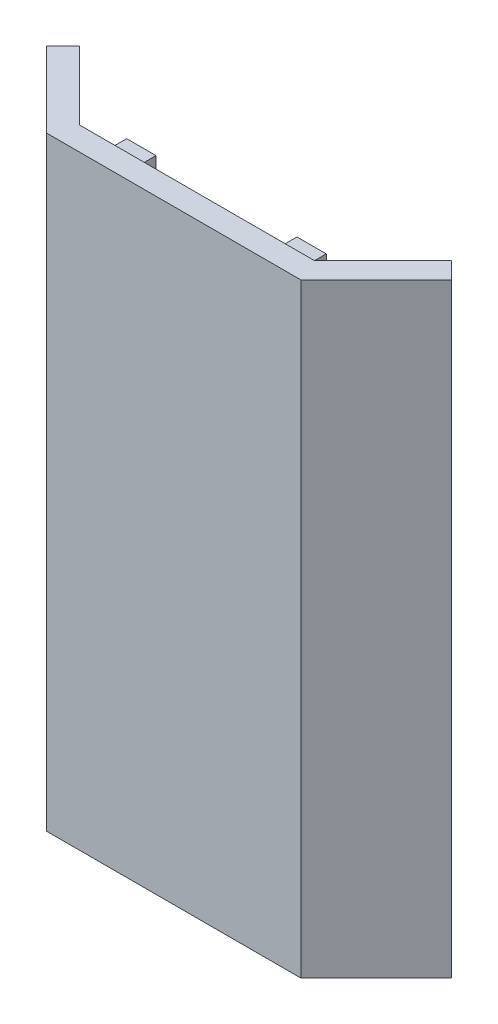
from build123d import *

# Parameters (mm, degrees)
SALIENTE_EXTRUIR1_DEPTH = 103
CROQUIS2_W              = 10
CROQUIS2_H              = 6
SALIENTE_EXTRUIR2_DEPTH = 10


with BuildPart() as part:
    # Croquis1 → Saliente-Extruir1 (new, symmetric)
    with BuildSketch(Plane(origin=(0, 0, 0), x_dir=(1, 0, 0), z_dir=(0, 1, 0))):
        Polygon((-40, 0), (40, 0), (63.334523779, 23.334523779), (68.991378029, 17.67766953), (43.313708499, -8), (-43.313708499, -8), (-68.991378029, 17.67766953), (-63.334523779, 23.334523779), align=None)
    extrude(amount=SALIENTE_EXTRUIR1_DEPTH, both=True)

    # Croquis2 → Saliente-Extruir2 (add)
    with BuildSketch(Plane(origin=(0, 0, 0), x_dir=(-1, 0, 0), z_dir=(0, 0, -1))):
        with Locations((29, -94)):
            Rectangle(CROQUIS2_W, CROQUIS2_H)
        with Locations((-29, -94)):
            Rectangle(CROQUIS2_W, CROQUIS2_H)
    saliente_extruir2 = extrude(amount=SALIENTE_EXTRUIR2_DEPTH)

    # Simetría2: Saliente-Extruir2 across plane
    add(saliente_extruir2.mirror(Plane.ZX))


solid = part.part
